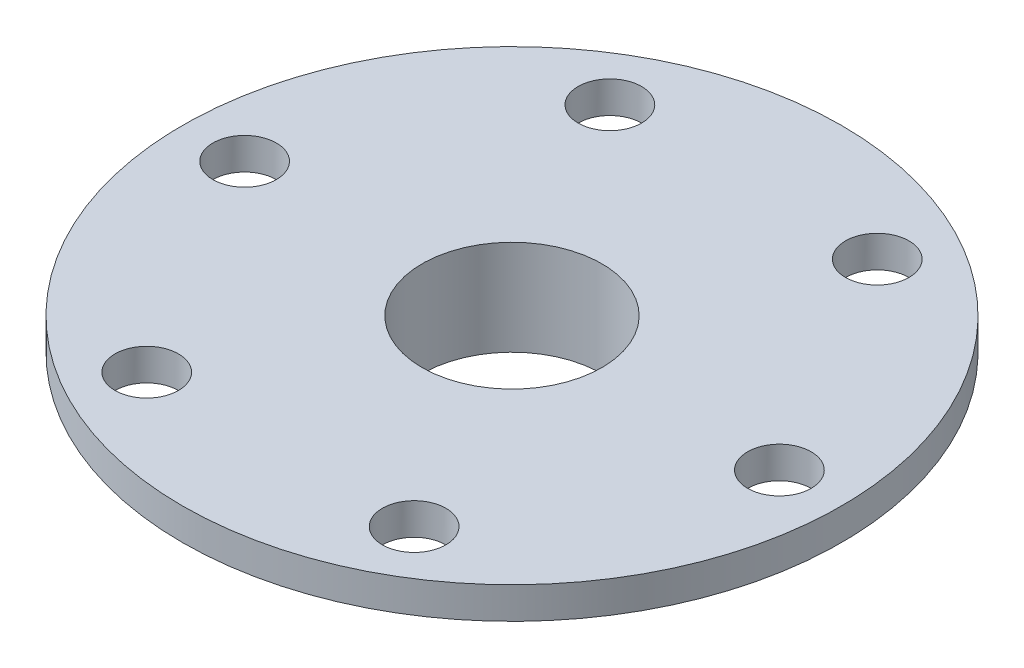
from build123d import *

# Parameters (mm, degrees)
SKETCH5_R          = 3
CUT_EXTRUDE1_DEPTH = 45.954046849


with BuildPart() as part:
    # Sketch4 → Revolve1 (revolve)
    with BuildSketch(Plane.XY, mode=Mode.PRIVATE) as revolve1_sk:
        Polygon((-8.5, 0), (-31.14375, 0), (-31.14375, -3), (-12.25, -3), (-12.25, -9), (-8.5, -9), align=None)
    revolve(revolve1_sk.sketch.rotate(Axis((0, 27.279243053, 0), (0, -1, 0)), 270), axis=Axis((0, 27.279243053, 0), (0, -1, 0)))

    # Sketch5 → Cut-Extrude1 (cut, through all)
    with BuildSketch(Plane(origin=(0, 0, 0), x_dir=(1, 0, 0), z_dir=(0, 1, 0))):
        with Locations(Location((-25.26875, 0, 0), (0, 0, 270))):
            Circle(SKETCH5_R)
        with Locations(Location((-12.634375, 21.883379422, 0), (0, 0, 270))):
            Circle(SKETCH5_R)
        with Locations(Location((12.634375, 21.883379422, 0), (0, 0, 270))):
            Circle(SKETCH5_R)
        with Locations(Location((25.26875, 0, 0), (0, 0, 270))):
            Circle(SKETCH5_R)
        with Locations(Location((12.634375, -21.883379422, 0), (0, 0, 270))):
            Circle(SKETCH5_R)
        with Locations(Location((-12.634375, -21.883379422, 0), (0, 0, 270))):
            Circle(SKETCH5_R)
    extrude(amount=-CUT_EXTRUDE1_DEPTH, mode=Mode.SUBTRACT)


solid = part.part
